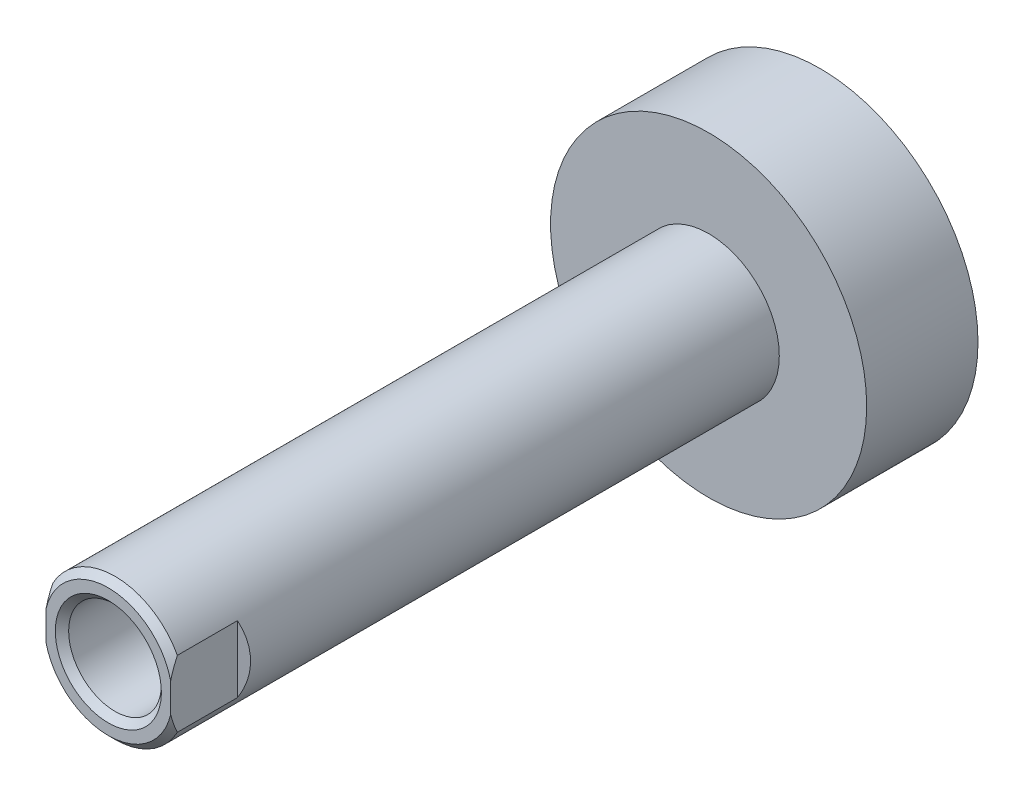
from build123d import *

# Parameters (mm, degrees)
SKETCH1_R                              = 7.1
PISTON_DEPTH                           = 5
SKETCH2_R                              = 3.175
ROD_DEPTH                              = 31.964
F_056_8_32_INTERNAL_THREAD_D           = 3.4544
F_056_8_32_INTERNAL_THREAD_DEPTH       = 14.07744
F_056_8_32_INTERNAL_THREAD_CBORE_D     = 4.1656
F_056_8_32_INTERNAL_THREAD_CBORE_DEPTH = 11.684
F_056_8_32_INTERNAL_THREAD_TIP         = 1.037806461
ROD_END_CHAMFER_SIZE                   = 0.3
WRENCH_FLATS_DEPTH                     = 34.503989255
WRENCH_FLATS_DEPTH_BACK                = 34.503989255


with BuildPart() as part:
    # Sketch1 → Piston (new body)
    with BuildSketch(Plane.XY):
        Circle(SKETCH1_R)
    extrude(amount=PISTON_DEPTH)

    # Sketch2 → Rod (add)
    with BuildSketch(Plane(origin=(0, 0, 0), x_dir=(-1, 0, 0), z_dir=(0, 0, -1))):
        with Locations(Location((0, 0, 0), (0, 0, 90))):
            Circle(SKETCH2_R)
    extrude(amount=-ROD_DEPTH)

    # 056 #8-32 Internal Thread
    with Locations(Plane(origin=(0, 0, 31.964), x_dir=(0, 1, 0), z_dir=(0, 0, 1))):
        with Locations((0, 0)):
            CounterBoreHole(F_056_8_32_INTERNAL_THREAD_D / 2, F_056_8_32_INTERNAL_THREAD_CBORE_D / 2, F_056_8_32_INTERNAL_THREAD_CBORE_DEPTH, depth=F_056_8_32_INTERNAL_THREAD_DEPTH)
            with Locations((0, 0, -(F_056_8_32_INTERNAL_THREAD_DEPTH + F_056_8_32_INTERNAL_THREAD_TIP / 2))):  # 118° drill point
                Cone(0, F_056_8_32_INTERNAL_THREAD_D / 2, F_056_8_32_INTERNAL_THREAD_TIP, mode=Mode.SUBTRACT)

    # Rod End Chamfer
    rod_end_chamfer_edges = [part.edges().sort_by_distance(p)[0] for p in [
        (0, -2.0828, 31.964),
        (0, -3.175, 31.964),
    ]]
    chamfer(rod_end_chamfer_edges, length=ROD_END_CHAMFER_SIZE)

    # Sketch11 → Wrench Flats (cut, two sides: drawn at the far end of the back side and taken through both)
    with BuildSketch(Plane(origin=(0, 0, 0), x_dir=(1, 0, 0), z_dir=(0, 1, 0)).offset(-WRENCH_FLATS_DEPTH_BACK)):
        Polygon((-2.8, -31.964), (-2.8, -28.964), (-7.8, -26.077248654), (-7.8, -31.964), align=None)
        Polygon((2.8, -31.964), (2.8, -28.964), (7.8, -26.077248654), (7.8, -31.964), align=None)
    extrude(amount=WRENCH_FLATS_DEPTH + WRENCH_FLATS_DEPTH_BACK, mode=Mode.SUBTRACT)


solid = part.part
